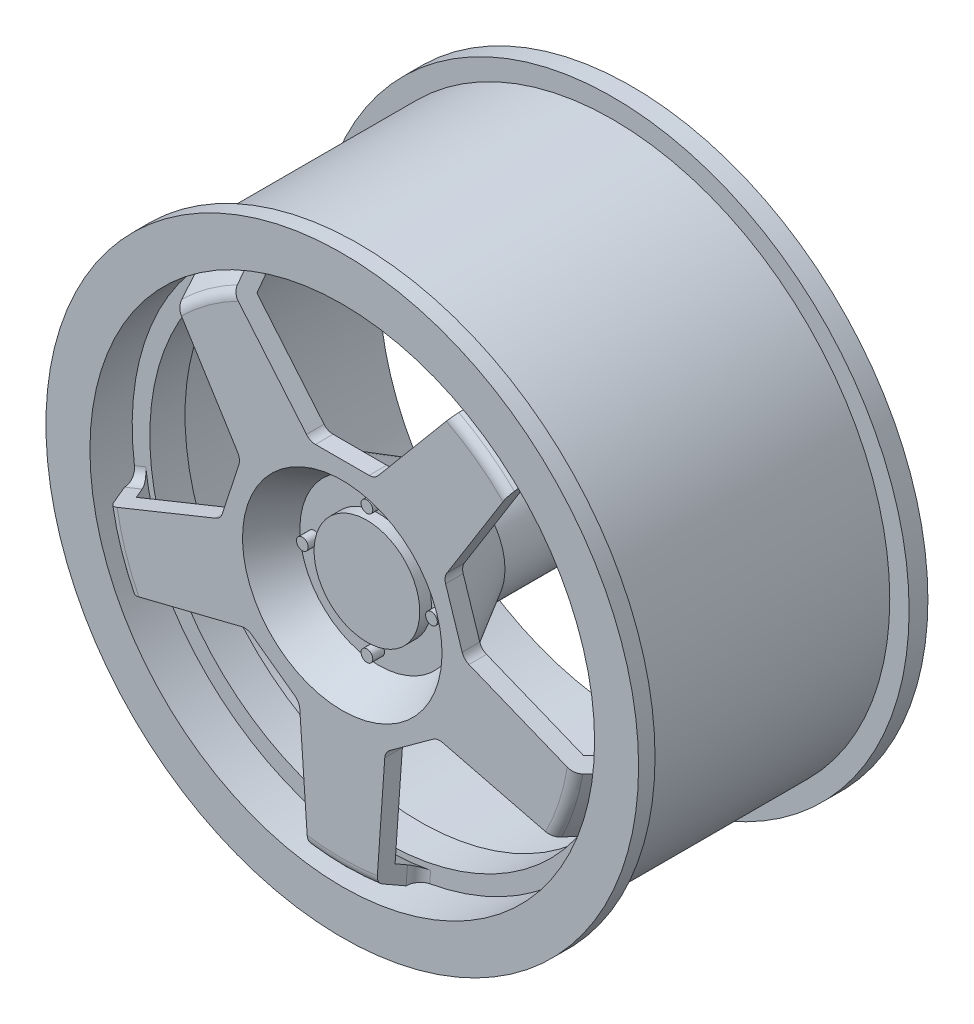
from build123d import *

# Parameters (mm, degrees)
CUT_EXTRUDE1_DEPTH       = 22.6
FILLET1_R                = 1
CUT_EXTRUDE2_START       = -3.6
CUT_EXTRUDE2_DEPTH       = 3.6
FILLET2_R                = 1
CIRPATTERN1_COUNT        = 5
FILLET2_OF_CIRPATTERN1_R = 1
SKETCH8_R                = 4.5
SKETCH8_R_2              = 0.5
BOSS_EXTRUDE1_DEPTH      = 1


with BuildPart() as part:
    # Sketch1 → Revolve1 (revolve)
    with BuildSketch(Plane(origin=(0, 0, 0), x_dir=(0, 0, -1), z_dir=(1, 0, 0))):
        Polygon((0, 25.25), (0, 21.5), (3.6, 21.5), (3.6, 20), (6.6, 20), (6.6, 21.5), (24.65, 21.5), (24.65, 25.25), (23.05, 25.25), (23.05, 23.6), (1.4, 23.6), (1.4, 25.25), align=None)
    revolve(axis=Axis((0, 0, 0), (0, 0, -1)))



with BuildPart() as body_2:
    # Sketch3 → Revolve2 (revolve)
    with BuildSketch(Plane(origin=(0, 0, 0), x_dir=(0, 0, -1), z_dir=(1, 0, 0))):
        Polygon((1.5, 0), (1.5, 9.25), (8.861215932, 5), (27.2, 5), (27.2, 0), align=None)
    revolve(axis=Axis((0, 0, 0), (0, 0, -1)))

    # Sketch4 → Cut-Extrude1 (cut)
    with BuildSketch(Plane(origin=(0, 0, -27.2), x_dir=(-1, 0, 0), z_dir=(0, 0, -1))):
        with BuildLine():
            ThreePointArc((2, 1.5), (0, 2.5), (-2, 1.5))
            Line((-2, 1.5), (-2, -1.5))
            ThreePointArc((-2, -1.5), (0, -2.5), (2, -1.5))
            Line((2, -1.5), (2, 1.5))
        make_face()
    extrude(amount=-CUT_EXTRUDE1_DEPTH, mode=Mode.SUBTRACT)


with BuildPart() as part_1:
    add(part.part)

    add(body_2.part)  # Revolve3 merges body 2
    # Sketch5 → Revolve3 (revolve)
    with BuildSketch(Plane(origin=(0, 0, 0), x_dir=(0, 0, -1), z_dir=(1, 0, 0))):
        Polygon((3.6, 20.5), (3.6, 21.5), (2.598076211, 21.5), (0, 20), (0, 0), (1.5, 0), (1.5, 19.287564435), align=None)
    revolve(axis=Axis((0, 0, 0), (0, 0, -1)))

    # Fillet1
    fillet1_edges = [part_1.edges().sort_by_distance(p)[0] for p in [
        (0, -20, 0),
    ]]
    fillet(fillet1_edges, radius=FILLET1_R)

    # Sketch6 → Cut-Extrude2 (cut)
    with BuildSketch(Plane.XY.offset(CUT_EXTRUDE2_START)):
        with BuildLine():
            Line((2.75, 10), (-2.75, 10))
            Line((-2.75, 10), (-10.227645858, 18.911511315))
            ThreePointArc((-10.227645858, 18.911511315), (0, 21.5), (10.227645858, 18.911511315))
            Line((10.227645858, 18.911511315), (2.75, 10))
        make_face()
    cut_extrude2 = extrude(amount=CUT_EXTRUDE2_DEPTH, mode=Mode.SUBTRACT)

    # Fillet2
    fillet2_edges = [part_1.edges().sort_by_distance(p)[0] for p in [
        (2.75, 10, -0.75),
        (-2.75, 10, -0.75),
        (9.899219367, 18.520107864, -3.6),
        (-9.899219367, 18.520107864, -3.6),
    ]]
    fillet(fillet2_edges, radius=FILLET2_R)

    # CirPattern1: Cut-Extrude2 ×5 about axis
    cirpattern1_axis = Axis((0, 0, 0), (0, 0, 1))
    for i in range(1, CIRPATTERN1_COUNT):
        add(cut_extrude2.rotate(cirpattern1_axis, i * 360 / CIRPATTERN1_COUNT), mode=Mode.SUBTRACT)

    # Fillet2 of CirPattern1
    fillet2_of_cirpattern1_edges = [part_1.edges().sort_by_distance(p)[0] for p in [
        (-8.660768428, 5.705575364, -0.75),
        (-10.360361897, 0.474764524, -0.75),
        (-14.554642252, 15.137745153, -3.6),
        (-20.672696282, -3.691689017, -3.6),
        (-8.102649257, -6.4737605, -0.75),
        (-3.653055788, -9.706579388, -0.75),
        (-18.894482972, -9.164466847, -3.6),
        (-2.877209575, -20.801697153, -3.6),
        (3.653055788, -9.706579388, -0.75),
        (8.102649257, -6.4737605, -0.75),
        (2.877209575, -20.801697153, -3.6),
        (18.894482972, -9.164466847, -3.6),
        (10.360361897, 0.474764524, -0.75),
        (8.660768428, 5.705575364, -0.75),
        (20.672696282, -3.691689017, -3.6),
        (14.554642252, 15.137745153, -3.6),
    ]]
    fillet(fillet2_of_cirpattern1_edges, radius=FILLET2_OF_CIRPATTERN1_R)

    # Sketch7 → Cut-Revolve1 (revolve, cut)
    with BuildSketch(Plane(origin=(0, 0, 0), x_dir=(0, 0, -1), z_dir=(1, 0, 0))):
        Polygon((0, 0), (0, 8.5), (3.1, 6.710214166), (3.1, 0), align=None)
    revolve(axis=Axis((0, 0, 0), (0, 0, -1)), mode=Mode.SUBTRACT)

    # Sketch8 → Boss-Extrude1 (add)
    with BuildSketch(Plane.XY.offset(-3.1)):
        Circle(SKETCH8_R)
        with Locations((0, 5.5)):
            Circle(SKETCH8_R_2)
        with Locations((5.5, 0)):
            Circle(SKETCH8_R_2)
        with Locations((0, -5.5)):
            Circle(SKETCH8_R_2)
        with Locations((-5.5, 0)):
            Circle(SKETCH8_R_2)
    extrude(amount=BOSS_EXTRUDE1_DEPTH)


solid = part_1.part
